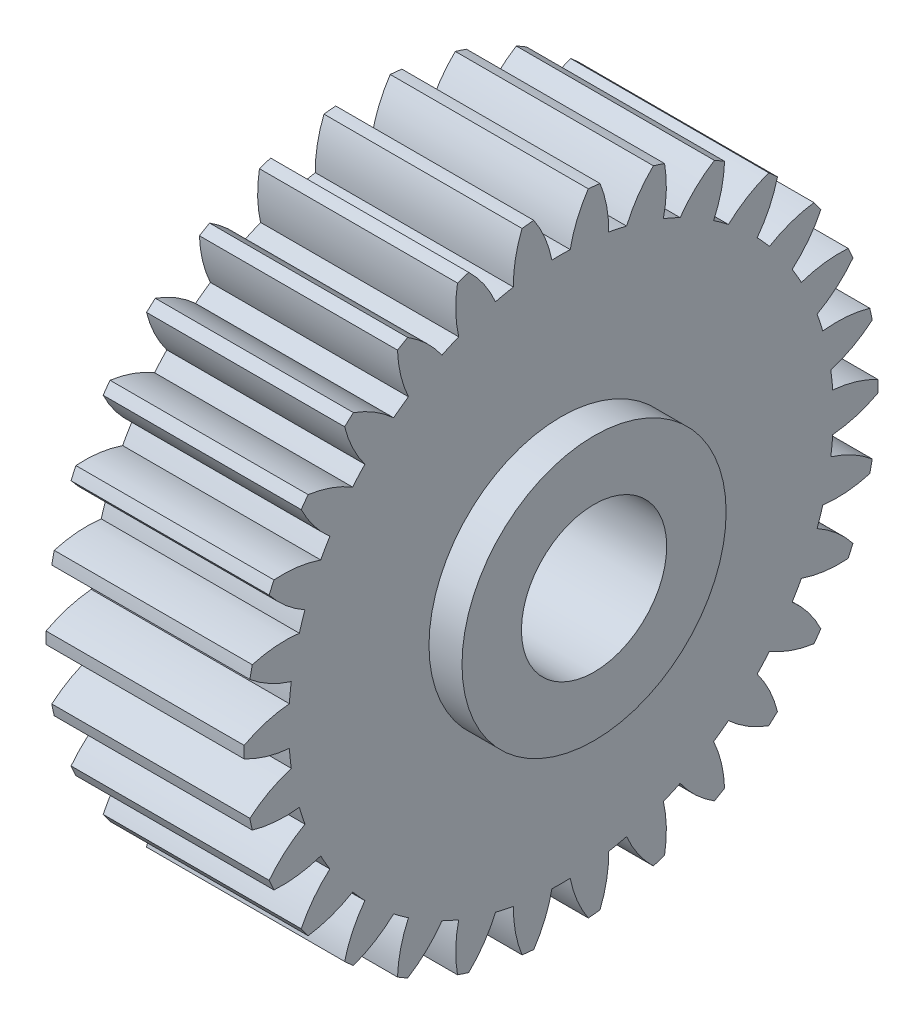
from build123d import *

# Parameters (mm, degrees)
BASPROSKE_W       = 30
BASPROSKE_H       = 48
TOOTHCUT_DEPTH    = 75.215901261
TEETHCUTS_COUNT   = 30
TEETHCUTS_ANGLE   = 348
HUBNEABOTSKE_R    = 20
HUBNEARBOTH_DEPTH = 5.0000254
HUBFAR_START      = 5.0000254
HUBFARSKE_R       = 20
HUBFAR_DEPTH      = 5.0000254
BORSKE_R          = 11
BORE_DEPTH        = 40.0000508


with BuildPart() as part:
    # BasProSke → Base-Revolve (revolve)
    with BuildSketch(Plane(origin=(0, 0, 0), x_dir=(1, 0, 0), z_dir=(0, 1, 0)), mode=Mode.PRIVATE) as base_revolve_sk:
        with Locations((15, 24)):
            Rectangle(BASPROSKE_W, BASPROSKE_H)
    revolve(base_revolve_sk.sketch.rotate(Axis((-10, 0, 0), (1, 0, 0)), 180), axis=Axis((-10, 0, 0), (1, 0, 0)))

    # TooCutSke → ToothCut (cut, through all)
    with BuildSketch(Plane(origin=(0, 0, 0), x_dir=(0, 0, -1), z_dir=(1, 0, 0))):
        with BuildLine():
            ThreePointArc((1.388358102, 41.225628713), (0, 41.249), (-1.388358102, 41.225628713))
            ThreePointArc((-1.388358102, 41.225628713), (-2.434419088, 44.674608087), (-4.146627223, 47.846050285))
            ThreePointArc((-4.146627223, 47.846050285), (0, 48.0254), (4.146627223, 47.846050285))
            ThreePointArc((4.146627223, 47.846050285), (2.434419088, 44.674608087), (1.388358102, 41.225628713))
        make_face()
    toothcut = extrude(amount=TOOTHCUT_DEPTH, mode=Mode.SUBTRACT)

    # TeethCuts: ToothCut ×30 about axis
    teethcuts_axis = Axis((-10, 0, 0), (1, 0, 0))
    for i in range(1, TEETHCUTS_COUNT):
        add(toothcut.rotate(teethcuts_axis, i * TEETHCUTS_ANGLE / (TEETHCUTS_COUNT - 1)), mode=Mode.SUBTRACT)

    # HubNeaBotSke → HubNearBoth (add)
    with BuildSketch(Plane.ZY):
        with Locations(Location((0, 0, 0), (0, 0, 180))):
            Circle(HUBNEABOTSKE_R)
    extrude(amount=HUBNEARBOTH_DEPTH)

    # HubFarSke → HubFar (add)
    with BuildSketch(Plane(origin=(30, 0, 0), x_dir=(0, 0, -1), z_dir=(1, 0, 0)).offset(HUBFAR_START)):
        Circle(HUBFARSKE_R)
    extrude(amount=-HUBFAR_DEPTH)

    # BorSke → Bore (cut, symmetric)
    with BuildSketch(Plane(origin=(0, 0, 0), x_dir=(0, 0, -1), z_dir=(1, 0, 0))):
        with Locations(Location((0, 0, 0), (0, 0, 180))):
            Circle(BORSKE_R)
    extrude(amount=BORE_DEPTH, both=True, mode=Mode.SUBTRACT)


solid = part.part
